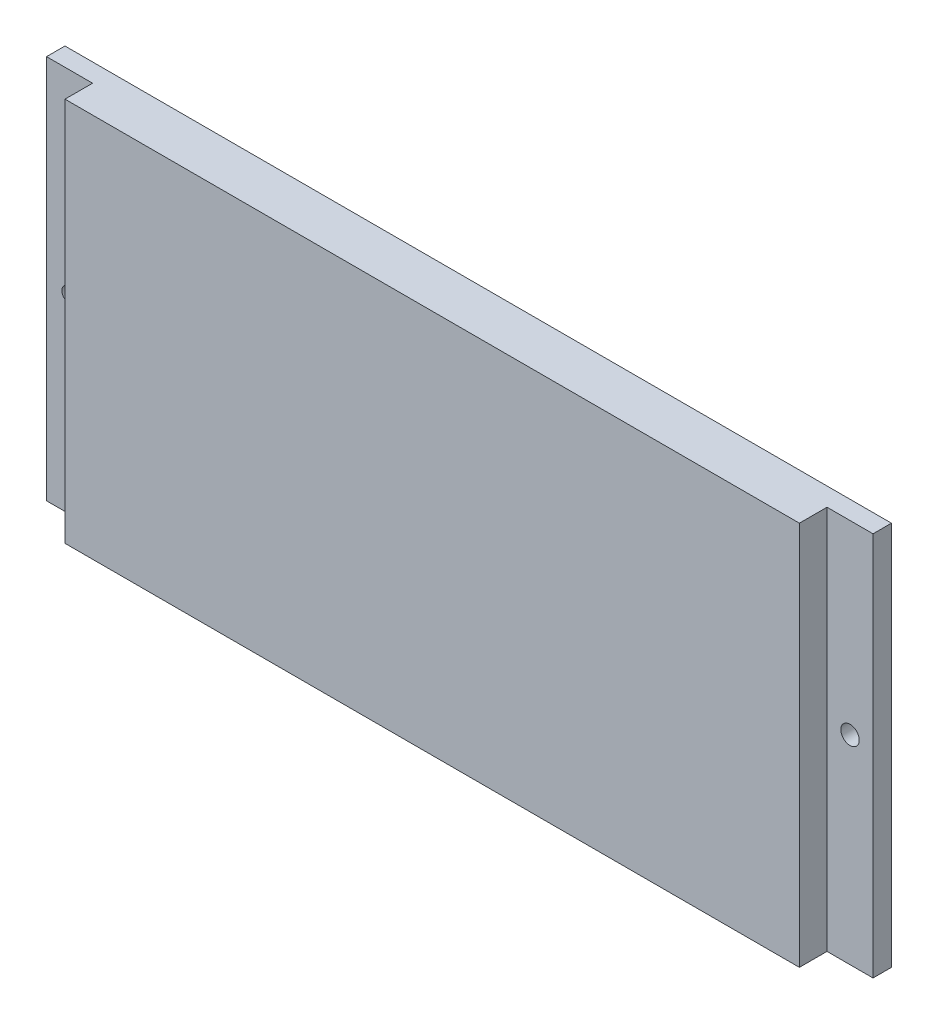
from build123d import *

# Parameters (mm, degrees)
SKETCH1_W           = 79.8
SKETCH1_H           = 41.8
BOSS_EXTRUDE1_DEPTH = 3
SKETCH2_W           = 89.8
SKETCH2_H           = 41.8
BOSS_EXTRUDE4_DEPTH = 2
SKETCH3_R           = 1
SKETCH3_R_2         = 0.833875984
CUT_EXTRUDE1_DEPTH  = 2


with BuildPart() as part:
    # Sketch1 → Boss-Extrude1 (new body)
    with BuildSketch(Plane.XY):
        with Locations((8.041732283, -0.726771654)):
            Rectangle(SKETCH1_W, SKETCH1_H)
    extrude(amount=BOSS_EXTRUDE1_DEPTH)

    # Sketch2 → Boss-Extrude4 (add)
    with BuildSketch(Plane(origin=(0, 0, 0), x_dir=(-1, 0, 0), z_dir=(0, 0, -1))):
        with Locations((-8.041732283, -0.726771654)):
            Rectangle(SKETCH2_W, SKETCH2_H)
    extrude(amount=BOSS_EXTRUDE4_DEPTH)

    # Sketch3 → Cut-Extrude1 (cut)
    with BuildSketch(Plane(origin=(0, 0, -2), x_dir=(-1, 0, 0), z_dir=(0, 0, -1))):
        with Locations((-50.441732283, 0)):
            Circle(SKETCH3_R)
        with Locations((34.358267717, -1)):
            Circle(SKETCH3_R_2)
    extrude(amount=-CUT_EXTRUDE1_DEPTH, mode=Mode.SUBTRACT)


solid = part.part
